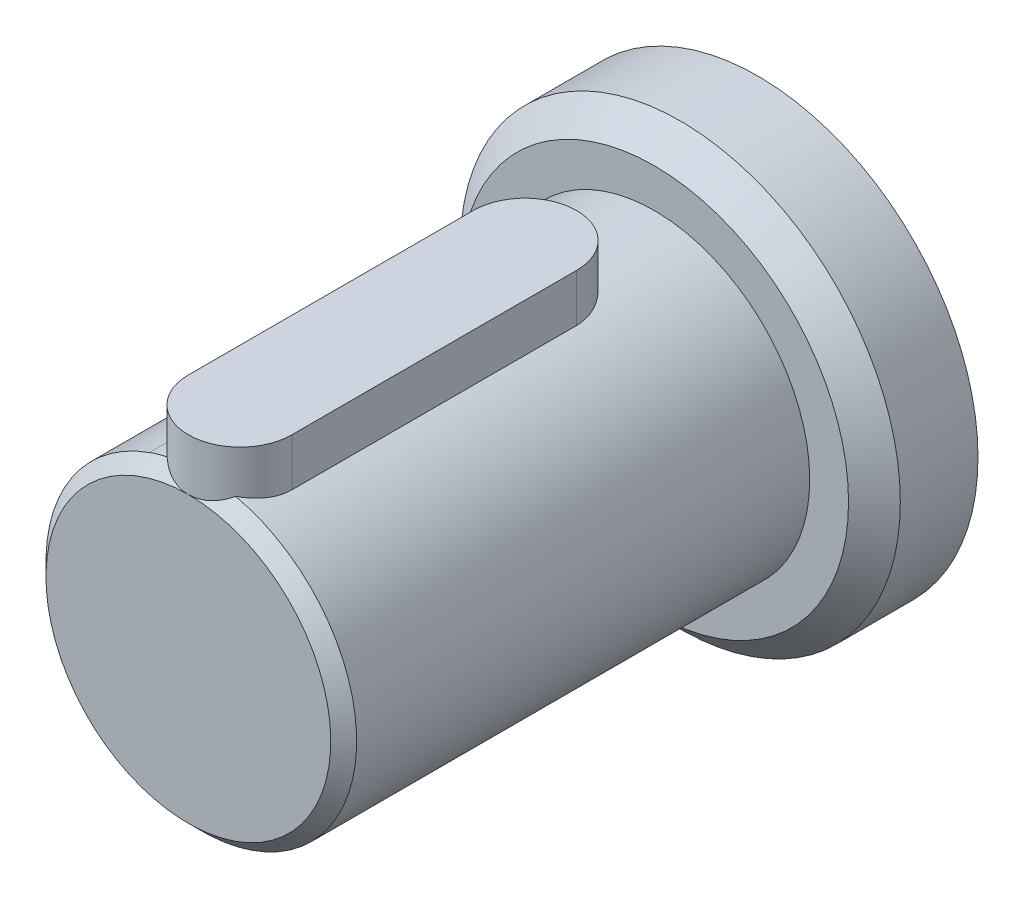
from build123d import *

# Parameters (mm, degrees)
ESQUISSE1_R             = 8.5
BOSS_EXTRU_1_DEPTH      = 4
ESQUISSE2_R             = 6
BOSS_EXTRU_2_DEPTH      = 18
CHANFREIN1_SIZE         = 1
CHANFREIN2_SIZE         = 0.5
BOSS_EXTRU_3_DEPTH      = 1.5
BOSS_EXTRU_3_DEPTH_BACK = 1


with BuildPart() as part:
    # Esquisse1 → Boss.-Extru.1 (new body)
    with BuildSketch(Plane.XY):
        Circle(ESQUISSE1_R)
    extrude(amount=BOSS_EXTRU_1_DEPTH)

    # Esquisse2 → Boss.-Extru.2 (add)
    with BuildSketch(Plane.XY.offset(4)):
        Circle(ESQUISSE2_R)
    extrude(amount=BOSS_EXTRU_2_DEPTH)

    # Chanfrein1
    chanfrein1_edges = [part.edges().sort_by_distance(p)[0] for p in [
        (-8.5, 0, 4),
    ]]
    chamfer(chanfrein1_edges, length=CHANFREIN1_SIZE)

    # Chanfrein2
    chanfrein2_edges = [part.edges().sort_by_distance(p)[0] for p in [
        (-6, 0, 22),
    ]]
    chamfer(chanfrein2_edges, length=CHANFREIN2_SIZE)

    # Esquisse3 → Boss.-Extru.3 (add, two sides: drawn at the far end of the back side and taken through both)
    with BuildSketch(Plane(origin=(0, 6, 0), x_dir=(1, 0, 0), z_dir=(0, 1, 0)).offset(-BOSS_EXTRU_3_DEPTH_BACK)):
        with BuildLine():
            Line((-2, -20), (-2, -9))
            ThreePointArc((-2, -9), (0, -7), (2, -9))
            Line((2, -9), (2, -20))
            ThreePointArc((2, -20), (0, -22), (-2, -20))
        make_face()
    extrude(amount=BOSS_EXTRU_3_DEPTH + BOSS_EXTRU_3_DEPTH_BACK)


solid = part.part
